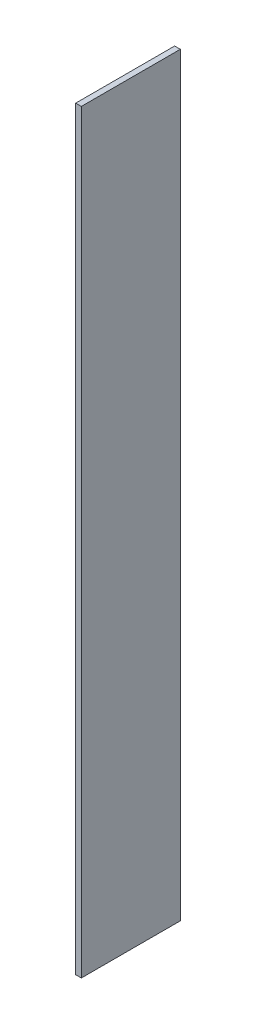
from build123d import *

# Parameters (mm, degrees)
SKETCH_1_W      = 4
SKETCH_1_H      = 69.902278357
EXTRUDE_1_DEPTH = 533.213673317


with BuildPart() as part:
    # Эскиз1 → Вытянуть1 (new body)
    with BuildSketch(Plane(origin=(0, 0, 0), x_dir=(1, 0, 0), z_dir=(0, 1, 0))):
        with Locations((3, -24.802944978)):
            Rectangle(SKETCH_1_W, SKETCH_1_H)
    extrude(amount=EXTRUDE_1_DEPTH)


solid = part.part
